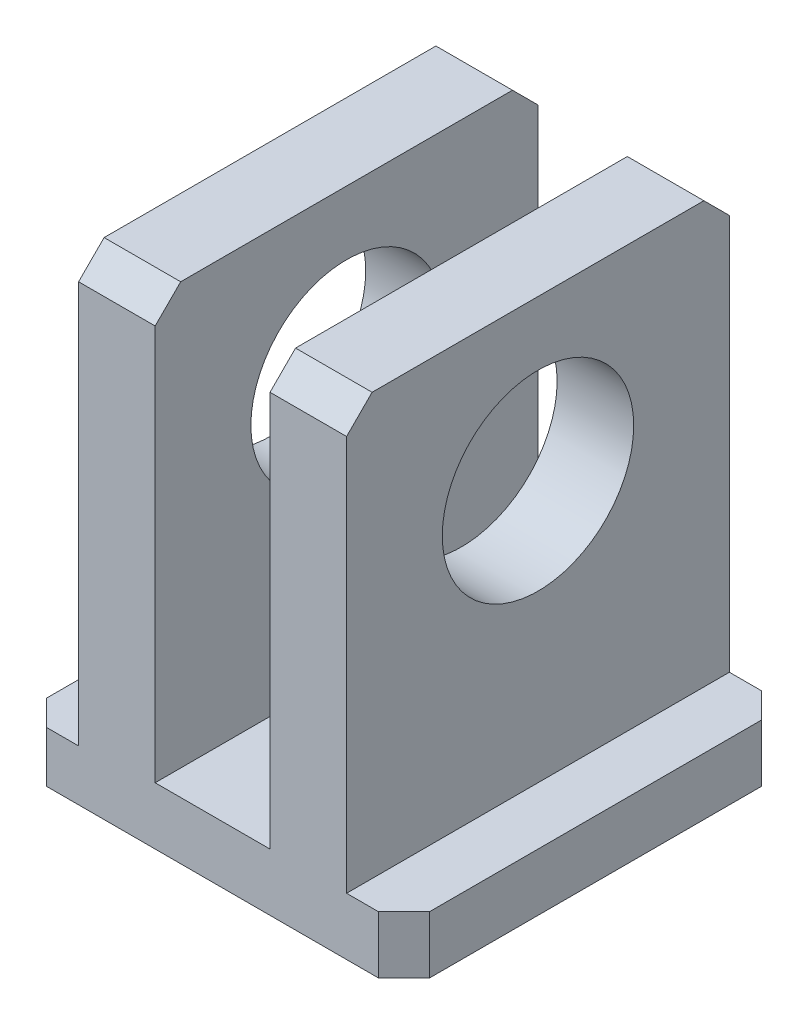
from build123d import *

# Parameters (mm, degrees)
EXTRUDE_1_DEPTH          = 37.5
SKETCH_4_W               = 2.5
SKETCH_4_H               = 30
CUT_EXTRUDE_2_DEPTH      = 33.5
CUT_EXTRUDE_3_DEPTH      = 44.084219849
CUT_EXTRUDE_3_DEPTH_BACK = 33.5
CUT_EXTRUDE_4_DEPTH      = 33
SKETCH_12_W              = 9
SKETCH_12_H              = 30
CUT_EXTRUDE_7_DEPTH      = 33
CUT_EXTRUDE_8_REACH      = 49.765
SKETCH_16_R              = 7.5
CHAMFER_2_SIZE           = 2


with BuildPart() as part:
    # 草图1 → 凸台-拉伸1 (new body)
    with BuildSketch(Plane(origin=(0, 0, 0), x_dir=(1, 0, 0), z_dir=(0, 1, 0))):
        Polygon((13, -15), (15, -13), (15, 13), (13, 15), (-13, 15), (-15, 13), (-15, -13), (-13, -15), align=None)
    extrude(amount=EXTRUDE_1_DEPTH)

    # 草图4 → 切除-拉伸2 (cut)
    with BuildSketch(Plane(origin=(0, 37.5, 0), x_dir=(1, 0, 0), z_dir=(0, 1, 0))):
        with Locations((-11.75, 0)):
            Rectangle(SKETCH_4_W, SKETCH_4_H)
    extrude(amount=-CUT_EXTRUDE_2_DEPTH, mode=Mode.SUBTRACT)

    # 草图9 → 切除-拉伸3 (cut, two sides: drawn at the far end of the back side and taken through both)
    with BuildSketch(Plane(origin=(0, 37.5, 0), x_dir=(1, 0, 0), z_dir=(0, 1, 0)).offset(-CUT_EXTRUDE_3_DEPTH_BACK)):
        Polygon((-13, -15), (-13, 15), (-15, 13), (-15, -13), align=None)
    extrude(amount=CUT_EXTRUDE_3_DEPTH + CUT_EXTRUDE_3_DEPTH_BACK, mode=Mode.SUBTRACT)

    # 草图11 → 切除-拉伸4 (cut)
    with BuildSketch(Plane(origin=(0, 37.5, 0), x_dir=(1, 0, 0), z_dir=(0, 1, 0))):
        Polygon((10.5, -15), (10.5, 15), (13, 15), (15, 13), (15, -13), (13, -15), align=None)
    extrude(amount=-CUT_EXTRUDE_4_DEPTH, mode=Mode.SUBTRACT)

    # 草图12 → 切除-拉伸7 (cut)
    with BuildSketch(Plane(origin=(0, 37.5, 0), x_dir=(1, 0, 0), z_dir=(0, 1, 0))):
        Rectangle(SKETCH_12_W, SKETCH_12_H)
    extrude(amount=-CUT_EXTRUDE_7_DEPTH, mode=Mode.SUBTRACT)

    # 切除-拉伸8: up to this face of the body (flat: up to its plane)
    cut_extrude_8_end = Plane(part.part.faces().sort_by_distance((10.5, 21, 0))[0])
    # 草图16 → 切除-拉伸8 (cut, up to the picked face)
    with BuildSketch(Plane.ZY.offset(10.5), mode=Mode.PRIVATE) as cut_extrude_8_sk1:
        with Locations((0, 25)):
            Circle(SKETCH_16_R)
    cut_extrude_8_tool1 = split(extrude(cut_extrude_8_sk1.sketch, amount=-CUT_EXTRUDE_8_REACH, mode=Mode.PRIVATE), bisect_by=cut_extrude_8_end, keep=Keep.BOTH, mode=Mode.PRIVATE)
    add(cut_extrude_8_tool1.solids().sort_by(Axis((-10.5, 25, 0), (1, 0, 0)))[0], mode=Mode.SUBTRACT)

    # 倒角2
    chamfer_2_edges = [part.edges().sort_by_distance(p)[0] for p in [
        (-7.5, 37.5, 15),
        (-7.5, 37.5, -15),
        (7.5, 37.5, -15),
        (7.5, 37.5, 15),
    ]]
    chamfer(chamfer_2_edges, length=CHAMFER_2_SIZE)


solid = part.part
